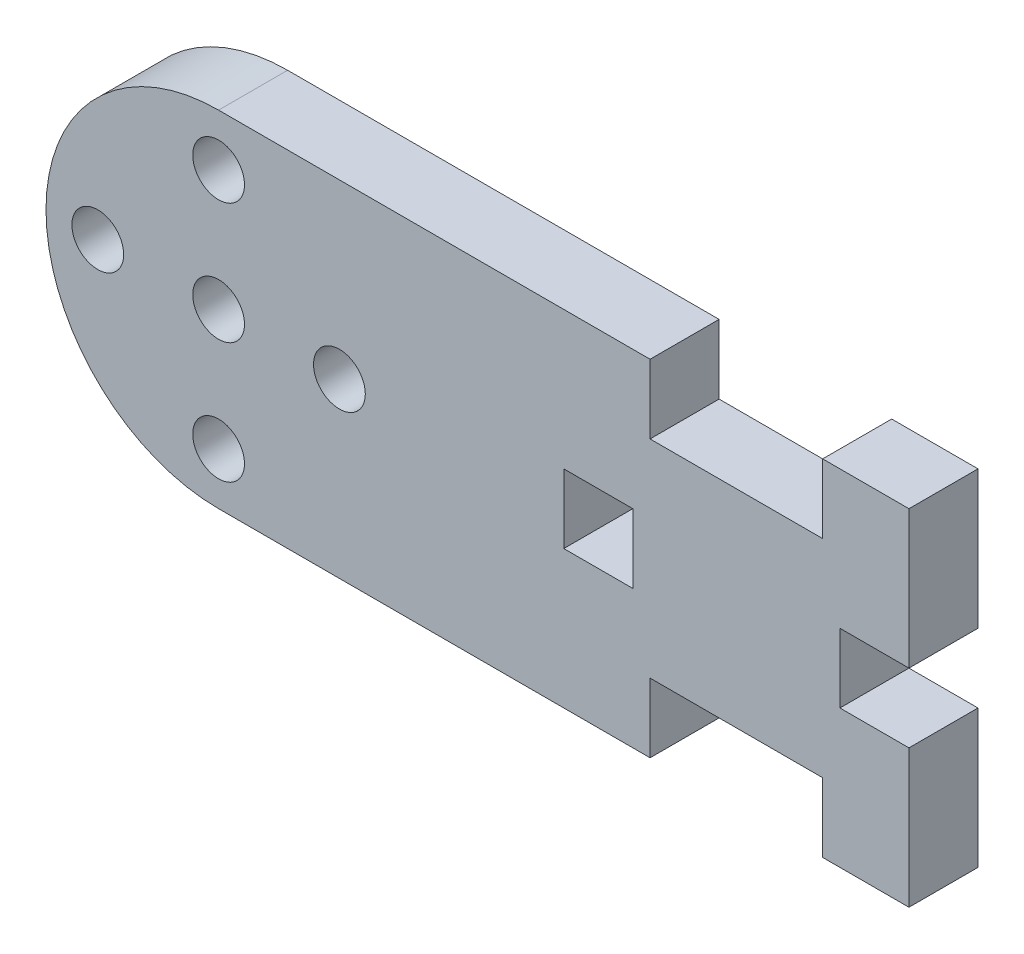
from build123d import *

# Parameters (mm, degrees)
SKETCH_1_R          = 1
SKETCH_1_R_2        = 1.5
EXTRUDE_1_DEPTH     = 4
SKETCH_2_W          = 10
SKETCH_2_H          = 4
SKETCH_2_W_2        = 4
CUT_EXTRUDE_3_DEPTH = 10


with BuildPart() as part:
    # Эскиз1 → Бобышка-Вытянуть1 (new body)
    with BuildSketch(Plane.XY):
        with BuildLine():
            Line((47, -12.5), (55, -12.5))
            Line((55, -12.5), (55, 12.5))
            Line((55, 12.5), (47, 12.5))
            Line((47, 12.5), (47, 10))
            Line((47, 10), (0, 10))
            ThreePointArc((0, 10), (-10, 0), (0, -10))
            Line((0, -10), (47, -10))
            Line((47, -10), (47, -12.5))
        make_face()
        with Locations((49, 10.5)):
            Circle(SKETCH_1_R, mode=Mode.SUBTRACT)
        with Locations(Location((49, -10.5, 0), (0, 0, 180))):
            Circle(SKETCH_1_R, mode=Mode.SUBTRACT)
        Circle(SKETCH_1_R_2, mode=Mode.SUBTRACT)
        with Locations((0, 7)):
            Circle(SKETCH_1_R_2, mode=Mode.SUBTRACT)
        with Locations((7, 0)):
            Circle(SKETCH_1_R_2, mode=Mode.SUBTRACT)
        with Locations((0, -7)):
            Circle(SKETCH_1_R_2, mode=Mode.SUBTRACT)
        with Locations((-7, 0)):
            Circle(SKETCH_1_R_2, mode=Mode.SUBTRACT)
    extrude(amount=EXTRUDE_1_DEPTH)

    # Эскиз2 → Вырез-Вытянуть3 (cut)
    with BuildSketch(Plane.XY.offset(4)):
        with Locations((30, 8)):
            Rectangle(SKETCH_2_W, SKETCH_2_H)
        with Locations((30, -8)):
            Rectangle(SKETCH_2_W, SKETCH_2_H)
        with Locations((22, 0)):
            Rectangle(SKETCH_2_W_2, SKETCH_2_H)
        Polygon((36, -2), (40, -2), (40, -18.487947924), (59.066234822, -18.487947924), (59.066234822, 17.495643995), (40, 17.495643995), (40, 2), (36, 2), align=None)
    extrude(amount=-CUT_EXTRUDE_3_DEPTH, mode=Mode.SUBTRACT)


solid = part.part
